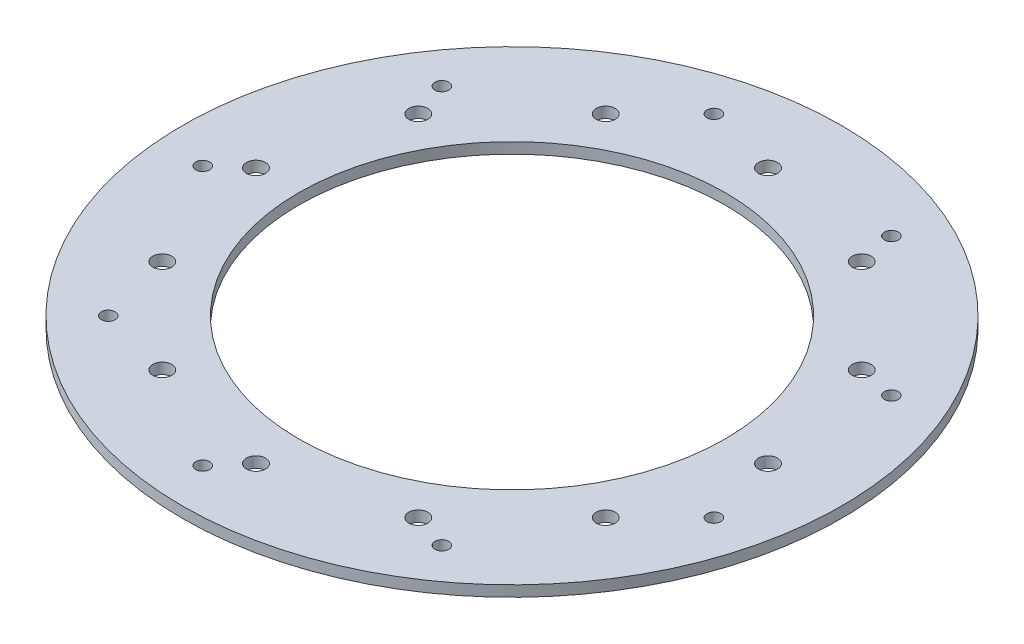
from build123d import *

# Parameters (mm, degrees)
SKETCH1_R           = 76.182
SKETCH1_R_2         = 49.3
BOSS_EXTRUDE1_DEPTH = 2.5
SKETCH2_R           = 1.6
CUT_EXTRUDE1_DEPTH  = 108.766619359
SKETCH3_R           = 2.2
CUT_EXTRUDE2_DEPTH  = 108.766619359
CIRPATTERN1_COUNT   = 9


with BuildPart() as part:
    # Sketch1 → Boss-Extrude1 (new body)
    with BuildSketch(Plane(origin=(0, 0, 0), x_dir=(1, 0, 0), z_dir=(0, 1, 0))):
        with Locations(Location((0, 0, 0), (0, 0, 270))):
            Circle(SKETCH1_R)
        with Locations(Location((0, 0, 0), (0, 0, 270))):
            Circle(SKETCH1_R_2, mode=Mode.SUBTRACT)
    extrude(amount=BOSS_EXTRUDE1_DEPTH)

    # Sketch2 → Cut-Extrude1 (cut, through all)
    with BuildSketch(Plane(origin=(0, 2.5, 0), x_dir=(1, 0, 0), z_dir=(0, 1, 0))):
        with Locations(Location((-65.748850074, -5.752279021, 0), (0, 0, 270))):
            Circle(SKETCH2_R)
    cut_extrude1 = extrude(amount=-CUT_EXTRUDE1_DEPTH, mode=Mode.SUBTRACT)

    # Sketch3 → Cut-Extrude2 (cut, through all)
    with BuildSketch(Plane(origin=(0, 2.5, 0), x_dir=(1, 0, 0), z_dir=(0, 1, 0))):
        with Locations(Location((0, 59.18, 0), (0, 0, 270))):
            Circle(SKETCH3_R)
        with Locations(Location((29.59, 51.251383396, 0), (0, 0, 270))):
            Circle(SKETCH3_R)
        with Locations(Location((51.251383396, 29.59, 0), (0, 0, 270))):
            Circle(SKETCH3_R)
        with Locations(Location((59.18, 0, 0), (0, 0, 270))):
            Circle(SKETCH3_R)
        with Locations(Location((51.251383396, -29.59, 0), (0, 0, 270))):
            Circle(SKETCH3_R)
        with Locations(Location((29.59, -51.251383396, 0), (0, 0, 270))):
            Circle(SKETCH3_R)
        with Locations(Location((0, -59.18, 0), (0, 0, 270))):
            Circle(SKETCH3_R)
        with Locations(Location((-29.59, -51.251383396, 0), (0, 0, 270))):
            Circle(SKETCH3_R)
        with Locations(Location((-51.251383396, -29.59, 0), (0, 0, 270))):
            Circle(SKETCH3_R)
        with Locations(Location((-59.18, 0, 0), (0, 0, 270))):
            Circle(SKETCH3_R)
        with Locations(Location((-51.251383396, 29.59, 0), (0, 0, 270))):
            Circle(SKETCH3_R)
        with Locations(Location((-29.59, 51.251383396, 0), (0, 0, 270))):
            Circle(SKETCH3_R)
    extrude(amount=-CUT_EXTRUDE2_DEPTH, mode=Mode.SUBTRACT)

    # CirPattern1: Cut-Extrude1 ×9 about axis
    cirpattern1_axis = Axis((0, 0, 0), (0, 1, 0))
    for i in range(1, CIRPATTERN1_COUNT):
        add(cut_extrude1.rotate(cirpattern1_axis, i * 360 / CIRPATTERN1_COUNT), mode=Mode.SUBTRACT)


solid = part.part
